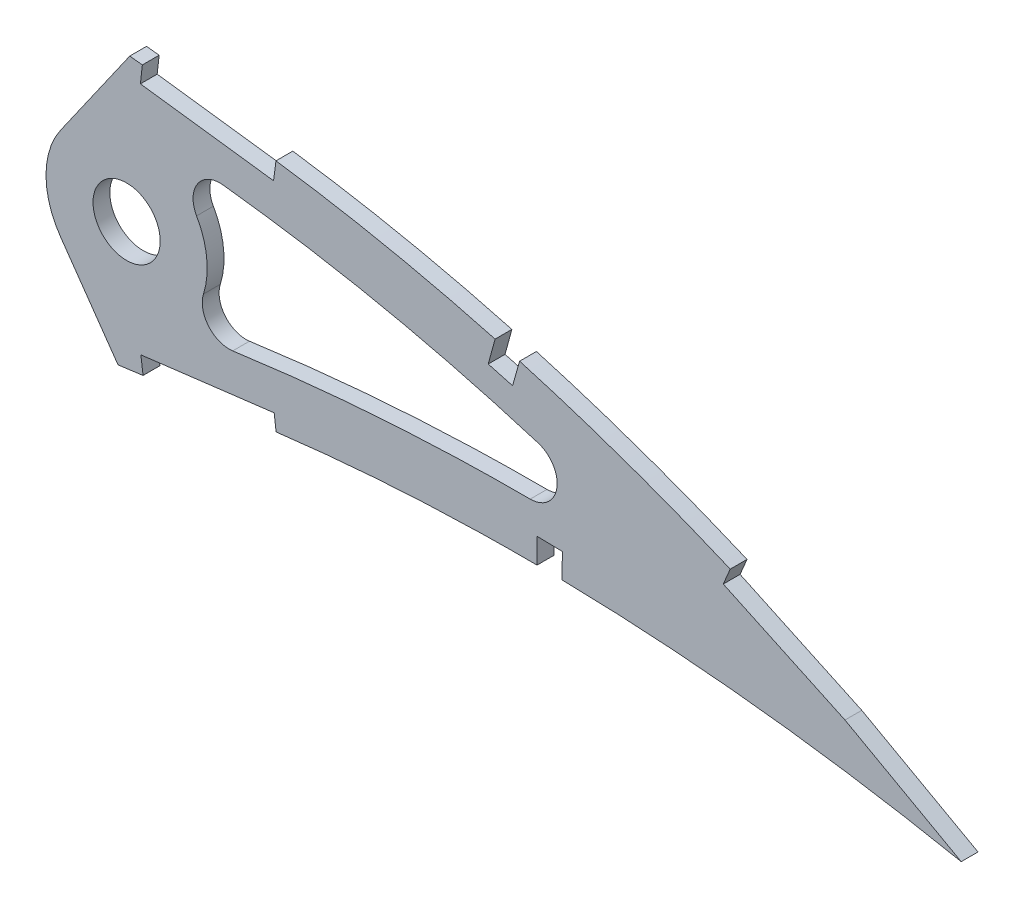
from build123d import *

# Parameters (mm, degrees)
BOSS_EXTRUDE1_DEPTH = 3.175
SKETCH3_R           = 6.35
CUT_EXTRUDE2_DEPTH  = 7.62
CUT_EXTRUDE3_DEPTH  = 477.963187519
CUT_EXTRUDE4_DEPTH  = 477.282156445
FILLET1_R           = 5.08


with BuildPart() as part:
    # Sketch1 → Boss-Extrude1 (new body)
    with BuildSketch(Plane.XY):
        with BuildLine():
            Line((468.834634376, -0.731838708), (473.237631437, -1.626460605))
            Line((473.237631437, -1.626460605), (469.420105342, 0.731838708))
            add(Edge.make_bspline(
                [(469.420105342, 0.731838708), (469.384144743, 0.75405358), (469.240441949, 0.842826831), (468.916653521, 1.041434293), (468.377478456, 1.372225024), (467.622680377, 1.832901279), (466.652845475, 2.422239826), (465.467485908, 3.136113979), (464.067341521, 3.972204372), (462.452751187, 4.926556606), (460.623880493, 5.99470234), (458.581425768, 7.172314172), (456.325564704, 8.452725095), (453.857171213, 9.830703338), (451.177092175, 11.299695359), (448.285834578, 12.853066351), (445.184433662, 14.482914856), (441.87408004, 16.182230896), (438.355377166, 17.941630348), (434.629984045, 19.753790881), (430.699141968, 21.609677497), (426.564192467, 23.499388025), (422.22751115, 25.41521975), (417.69029685, 27.345261464), (412.955135305, 29.281151436), (408.024042449, 31.211871947), (402.899937976, 33.12863011), (397.58479872, 35.019008566), (392.082597846, 36.874746386), (386.396004495, 38.68378787), (380.529085336, 40.436308543), (374.485249168, 42.120945686), (368.269534158, 43.72905958), (361.885882446, 45.248939331), (355.339704572, 46.670411418), (348.63620397, 47.984917711), (341.781002635, 49.179334611), (334.793097003, 50.252730987), (327.784920922, 51.145614984), (320.79116359, 52.021329621), (313.807821665, 52.843983365), (306.739128647, 53.631788144), (299.591885106, 54.380308437), (292.373180531, 55.087203561), (285.090322746, 55.749422771), (277.750880063, 56.365023912), (270.361954303, 56.930518839), (262.931336863, 57.445036287), (255.466373755, 57.904053071), (247.975016147, 58.307224442), (240.464868712, 58.651738691), (232.943747029, 58.935221873), (225.419637453, 59.155962801), (217.900350262, 59.311846649), (210.394026923, 59.401893322), (202.908475182, 59.423642443), (195.451832721, 59.376704816), (188.031907868, 59.259468925), (180.656846602, 59.07032975), (173.334467891, 58.808934388), (166.072689758, 58.475396129), (158.879463115, 58.066921878), (151.76259133, 57.586114694), (144.729999608, 57.030954849), (137.789414782, 56.401294687), (130.948110641, 55.699758895), (124.213703919, 54.924439317), (117.593411838, 54.077542083), (111.094475675, 53.160727588), (104.72418742, 52.173496373), (98.489371058, 51.118700137), (92.396755747, 49.997417995), (86.452787451, 48.81293722), (80.663937566, 47.565566874), (75.036333929, 46.259048591), (69.57582504, 44.895658843), (64.288280855, 43.477893405), (59.179061403, 42.009154361), (54.253333229, 40.492773824), (49.516838534, 38.930418047), (44.973157087, 37.328010693), (40.627870346, 35.686689303), (36.484306892, 34.011510412), (32.547322707, 32.304761192), (28.819858841, 30.571644792), (25.306133953, 28.814134252), (22.008652271, 27.037153572), (18.930724245, 25.243427453), (16.07531265, 23.436287722), (13.44361768, 21.620318123), (11.039267644, 19.796658613), (8.863088517, 17.969917436), (6.916457434, 16.142876281), (5.20215694, 14.316793669), (3.720125296, 12.494885385), (2.472304781, 10.678594294), (1.458911867, 8.869639065), (0.682238714, 7.069333725), (0.141515122, 5.278690749), (-0.154473369, 3.500353053), (-0.228146672, 1.732894981), (-0.07593526, 0.576768576), (0, 0)],
                knots=[0, 0, 0, 0, 0.00025409, 0.001015373, 0.002283359, 0.004056577, 0.006330982, 0.009105274, 0.012374489, 0.016134023, 0.020379661, 0.025105976, 0.030306237, 0.035972206, 0.042099522, 0.048678064, 0.055701664, 0.063160184, 0.071045824, 0.079349827, 0.08806291, 0.097175757, 0.106678111, 0.116561573, 0.126814276, 0.137428301, 0.148393618, 0.15969976, 0.171338125, 0.183297699, 0.195569604, 0.208143556, 0.221011593, 0.234161831, 0.24758745, 0.261276822, 0.27522271, 0.289414144, 0.3037712, 0.317689226, 0.331784111, 0.346039677, 0.36044387, 0.374982721, 0.389640454, 0.404403317, 0.4192566, 0.434186749, 0.449177265, 0.464214782, 0.479284009, 0.49436974, 0.509457833, 0.524532346, 0.53957932, 0.554582984, 0.569529546, 0.584403417, 0.599190992, 0.613876838, 0.628447475, 0.642888675, 0.657186054, 0.671325546, 0.685294014, 0.699078147, 0.712665095, 0.726042645, 0.739197713, 0.752117586, 0.764792042, 0.777208152, 0.789355685, 0.80122396, 0.812803686, 0.824082909, 0.835054602, 0.845709571, 0.856037853, 0.866033834, 0.875688843, 0.884997719, 0.893953426, 0.902552897, 0.910789386, 0.918660734, 0.926166253, 0.933302626, 0.94007122, 0.94647478, 0.952517526, 0.958204819, 0.963546652, 0.9685566, 0.973249913, 0.977651041, 0.981787043, 0.985694226, 0.989415109, 0.993001157, 0.996508416, 1, 1, 1, 1], degree=3))
            add(Edge.make_bspline(
                [(0, 0), (0.120545422, -0.569054782), (0.362190271, -1.709779619), (1.018707782, -3.35195076), (1.886920844, -4.930552911), (2.985051288, -6.441392915), (4.305797565, -7.884057869), (5.846242644, -9.260048331), (7.604875869, -10.568624397), (9.57939547, -11.809190578), (11.766933151, -12.983063792), (14.165030149, -14.089514173), (16.771499867, -15.128195969), (19.583502489, -16.097720727), (22.597600275, -16.999564994), (25.810927556, -17.83153108), (29.219830482, -18.594781746), (32.82103031, -19.287368785), (36.610602861, -19.909995783), (40.584611298, -20.462314276), (44.738976581, -20.94466978), (49.069622971, -21.356050059), (53.572267018, -21.697340041), (58.242420882, -21.968766107), (63.07555133, -22.171188915), (68.067028727, -22.30383895), (73.21196449, -22.368784292), (78.505709034, -22.366999873), (83.943083827, -22.298008468), (89.519444052, -22.165621357), (95.229438588, -21.969000009), (101.06791245, -21.710523747), (107.029599259, -21.392793842), (113.109152024, -21.016887343), (119.301220533, -20.584470276), (125.600428387, -20.099010447), (132.001053313, -19.561718629), (138.497513135, -18.97572672), (145.084056477, -18.343968166), (151.754992696, -17.668442476), (158.504433487, -16.952327301), (165.326367256, -16.197943271), (172.214990615, -15.40931492), (179.164010856, -14.587869186), (186.167551809, -13.738296088), (193.219024932, -12.862218898), (200.312533746, -11.963011893), (207.44169833, -11.044909074), (214.599844565, -10.107805674), (221.780951957, -9.158378258), (228.978095261, -8.195844739), (236.185009877, -7.225155571), (243.39502444, -6.249327898), (250.601116302, -5.268662037), (257.796951099, -4.287222096), (264.975853334, -3.307702419), (272.13079123, -2.33019238), (279.255291474, -1.35955068), (286.342179994, -0.395658656), (293.38492181, 0.559529456), (300.37676799, 1.503162571), (307.311122172, 2.434049592), (314.180831105, 3.351601668), (320.978983246, 4.256163344), (327.596964914, 5.120278953), (334.01748331, 5.989962795), (340.262174398, 6.702910859), (346.429111082, 7.311437642), (352.524699362, 7.810345682), (358.541619746, 8.206812681), (364.472978221, 8.503671562), (370.311705825, 8.705066897), (376.050427401, 8.816973355), (381.681975143, 8.842230751), (387.198662126, 8.788893941), (392.593313409, 8.66126226), (397.85839984, 8.46506453), (402.98657623, 8.20692007), (407.970558399, 7.89386613), (412.802863889, 7.530520429), (417.476759125, 7.125365523), (421.985033014, 6.684332445), (426.320762922, 6.212460013), (430.477622429, 5.719635759), (434.44895803, 5.209104646), (438.228796305, 4.68925635), (441.811052689, 4.165359017), (445.190053843, 3.644101417), (448.360490845, 3.130455994), (451.317242447, 2.631240452), (454.055677032, 2.151118888), (456.571042556, 1.694780117), (458.859849552, 1.267981745), (460.917577703, 0.872844052), (462.741474942, 0.515878932), (464.328149845, 0.198661447), (465.675276413, -0.074339095), (466.780502068, -0.302045374), (467.642148233, -0.480719316), (468.258513042, -0.610646491), (468.628929808, -0.68795975), (468.793510743, -0.723066602), (468.834634376, -0.731838708)],
                knots=[0, 0, 0, 0, 0.003638255, 0.007293231, 0.011028136, 0.014901081, 0.018963272, 0.023258475, 0.027820626, 0.032679082, 0.03785316, 0.043361875, 0.049214679, 0.055422346, 0.061988786, 0.068918036, 0.076211157, 0.083868392, 0.091887411, 0.100265912, 0.108999867, 0.118084529, 0.127514843, 0.13728527, 0.147387917, 0.157816481, 0.168563473, 0.179619128, 0.190977373, 0.202626974, 0.214560478, 0.226767249, 0.239236417, 0.251959004, 0.264923894, 0.278119703, 0.291536035, 0.30516028, 0.318980685, 0.332985499, 0.34716279, 0.361498603, 0.375980747, 0.390597192, 0.405332593, 0.420174823, 0.435109533, 0.450124276, 0.465203068, 0.480333154, 0.495500583, 0.510689775, 0.525887334, 0.541078314, 0.556247233, 0.571381785, 0.58646604, 0.601484516, 0.616424329, 0.631269423, 0.646006524, 0.660620684, 0.675098188, 0.689422858, 0.703581824, 0.716907564, 0.730009274, 0.742952128, 0.755725558, 0.768319952, 0.780724337, 0.792926528, 0.804916041, 0.816679084, 0.828203524, 0.8394749, 0.850481359, 0.861207697, 0.871639326, 0.881763414, 0.891563605, 0.901027364, 0.910138977, 0.918883976, 0.927249278, 0.935221104, 0.942784738, 0.949928188, 0.956638464, 0.962904204, 0.968712288, 0.974054485, 0.978918432, 0.983297218, 0.987180246, 0.990560674, 0.993433357, 0.995790626, 0.997629587, 0.998945816, 0.999736592, 1, 1, 1, 1], degree=3))
        make_face()
    extrude(amount=BOSS_EXTRUDE1_DEPTH)

    # Sketch3 → Cut-Extrude2 (cut)
    with BuildSketch(Plane(origin=(0, 0, 0), x_dir=(-1, 0, 0), z_dir=(0, 0, -1))):
        with Locations((-305.693087566, 26.255421435)):
            Circle(SKETCH3_R)
    extrude(amount=-CUT_EXTRUDE2_DEPTH, mode=Mode.SUBTRACT)

    # Sketch5 → Cut-Extrude3 (cut, through all)
    with BuildSketch(Plane.XY.offset(3.175)):
        with BuildLine():
            Line((297.512883475, 11.367834437), (293.209210411, 17.514116545))
            ThreePointArc((293.209210411, 17.514116545), (290.453087566, 26.255421435), (293.209210411, 34.996726325))
            Line((293.209210411, 34.996726325), (299.622888229, 44.156407516))
            Line((299.622888229, 44.156407516), (306.28625024, 53.672674691))
            add(Edge.make_bspline(
                [(306.28625024, 53.672674691), (304.062685855, 53.912052152), (299.432854271, 54.395881608), (292.373180531, 55.087203561), (285.090322746, 55.749422771), (277.750880063, 56.365023912), (270.361954303, 56.930518839), (262.931336863, 57.445036287), (255.466373755, 57.904053071), (247.975016147, 58.307224442), (240.464868712, 58.651738691), (232.943747029, 58.935221873), (225.419637453, 59.155962801), (217.900350262, 59.311846649), (210.394026923, 59.401893322), (202.908475182, 59.423642443), (195.451832721, 59.376704816), (188.031907868, 59.259468925), (180.656846602, 59.07032975), (173.334467891, 58.808934388), (166.072689758, 58.475396129), (159.219577295, 58.086235587), (154.78924534, 57.790330672), (152.756670288, 57.644702109)],
                knots=[0.347000218, 0.347000218, 0.347000218, 0.347000218, 0.36044387, 0.374982721, 0.389640454, 0.404403317, 0.4192566, 0.434186749, 0.449177265, 0.464214782, 0.479284009, 0.49436974, 0.509457833, 0.524532346, 0.53957932, 0.554582984, 0.569529546, 0.584403417, 0.599190992, 0.613876838, 0.628447475, 0.642888675, 0.655138283, 0.655138283, 0.655138283, 0.655138283], degree=3))
            add(Edge.make_bspline(
                [(152.756670288, 57.644702109), (152.416884114, 57.620357339), (149.731090186, 57.425745956), (144.729999608, 57.030954849), (137.789414782, 56.401294687), (130.948110641, 55.699758895), (124.213703919, 54.924439317), (117.593411838, 54.077542083), (111.094475675, 53.160727588), (104.72418742, 52.173496373), (98.489371058, 51.118700137), (92.396755747, 49.997417995), (86.452787451, 48.81293722), (80.663937566, 47.565566874), (75.036333929, 46.259048591), (69.57582504, 44.895658843), (64.288280855, 43.477893405), (59.179061403, 42.009154361), (54.253333229, 40.492773824), (49.516838534, 38.930418047), (44.973157087, 37.328010693), (40.627870346, 35.686689303), (36.484306892, 34.011510412), (32.547322707, 32.304761192), (28.819858841, 30.571644792), (25.306133953, 28.814134252), (22.008652271, 27.037153572), (18.930724245, 25.243427453), (16.07531265, 23.436287722), (13.44361768, 21.620318123), (11.039267644, 19.796658613), (8.863088517, 17.969917436), (6.916457434, 16.142876281), (5.20215694, 14.316793669), (3.720125296, 12.494885385), (2.472304781, 10.678594294), (1.458911867, 8.869639065), (0.682238714, 7.069333725), (0.141515122, 5.278690749), (-0.154473369, 3.500353053), (-0.228146672, 1.732894981), (-0.07593526, 0.576768576), (0, 0)],
                knots=[0.655138283, 0.655138283, 0.655138283, 0.655138283, 0.657186054, 0.671325546, 0.685294014, 0.699078147, 0.712665095, 0.726042645, 0.739197713, 0.752117586, 0.764792042, 0.777208152, 0.789355685, 0.80122396, 0.812803686, 0.824082909, 0.835054602, 0.845709571, 0.856037853, 0.866033834, 0.875688843, 0.884997719, 0.893953426, 0.902552897, 0.910789386, 0.918660734, 0.926166253, 0.933302626, 0.94007122, 0.94647478, 0.952517526, 0.958204819, 0.963546652, 0.9685566, 0.973249913, 0.977651041, 0.981787043, 0.985694226, 0.989415109, 0.993001157, 0.996508416, 1, 1, 1, 1], degree=3))
            add(Edge.make_bspline(
                [(0, 0), (0.120545422, -0.569054782), (0.362190271, -1.709779619), (1.018707782, -3.35195076), (1.886920844, -4.930552911), (2.985051288, -6.441392915), (4.305797565, -7.884057869), (5.846242644, -9.260048331), (7.604875869, -10.568624397), (9.57939547, -11.809190578), (11.766933151, -12.983063792), (14.165030149, -14.089514173), (16.771499867, -15.128195969), (19.583502489, -16.097720727), (22.597600275, -16.999564994), (25.810927556, -17.83153108), (29.219830482, -18.594781746), (32.82103031, -19.287368785), (36.610602861, -19.909995783), (40.584611298, -20.462314276), (44.738976581, -20.94466978), (49.069622971, -21.356050059), (53.572267018, -21.697340041), (58.242420882, -21.968766107), (63.07555133, -22.171188915), (68.067028727, -22.30383895), (73.21196449, -22.368784292), (78.505709034, -22.366999873), (83.943083827, -22.298008468), (89.519444052, -22.165621357), (95.229438588, -21.969000009), (101.06791245, -21.710523747), (107.029599259, -21.392793842), (113.109152024, -21.016887343), (119.301220533, -20.584470276), (125.600428387, -20.099010447), (132.001053313, -19.561718629), (138.497513135, -18.97572672), (145.084056477, -18.343968166), (151.754992696, -17.668442476), (158.504433487, -16.952327301), (165.326367256, -16.197943271), (172.214990615, -15.40931492), (178.413668021, -14.676567434), (182.315287371, -14.20522514), (183.900274287, -14.012143441)],
                knots=[0, 0, 0, 0, 0.003638255, 0.007293231, 0.011028136, 0.014901081, 0.018963272, 0.023258475, 0.027820626, 0.032679082, 0.03785316, 0.043361875, 0.049214679, 0.055422346, 0.061988786, 0.068918036, 0.076211157, 0.083868392, 0.091887411, 0.100265912, 0.108999867, 0.118084529, 0.127514843, 0.13728527, 0.147387917, 0.157816481, 0.168563473, 0.179619128, 0.190977373, 0.202626974, 0.214560478, 0.226767249, 0.239236417, 0.251959004, 0.264923894, 0.278119703, 0.291536035, 0.30516028, 0.318980685, 0.332985499, 0.34716279, 0.361498603, 0.375980747, 0.390597192, 0.400599477, 0.400599477, 0.400599477, 0.400599477], degree=3))
            Line((183.900274287, -14.012143441), (182.671674675, -3.926701309))
            add(Edge.make_bspline(
                [(182.671674675, -3.926701309), (194.509091827, -2.484677654), (218.145124651, 0.570902493), (247.751689591, 4.59382325), (271.453325847, 7.832408284), (286.063540768, 9.821970798), (294.75504791, 10.996225318), (297.512883475, 11.367834437)],
                knots=[0.400599477, 0.400599477, 0.400599477, 0.400599477, 0.475524542, 0.550449608, 0.587912141, 0.625374673, 0.642787324, 0.642787324, 0.642787324, 0.642787324], degree=3))
        make_face()
        with BuildLine():
            Line((304.072913741, 1.999140288), (297.512883475, 11.367834437))
            add(Edge.make_bspline(
                [(182.671674675, -3.926701309), (194.509091827, -2.484677654), (218.145124651, 0.570902493), (247.751689591, 4.59382325), (271.453325847, 7.832408284), (286.063540768, 9.821970798), (294.75504791, 10.996225318), (297.512883475, 11.367834437)],
                knots=[0.400599477, 0.400599477, 0.400599477, 0.400599477, 0.475524542, 0.550449608, 0.587912141, 0.625374673, 0.642787324, 0.642787324, 0.642787324, 0.642787324], degree=3))
            Line((182.671674675, -3.926701309), (183.900274287, -14.012143441))
            add(Edge.make_bspline(
                [(183.900274287, -14.012143441), (184.650295648, -13.920776504), (187.752075182, -13.541434417), (193.219024932, -12.862218898), (200.312533746, -11.963011893), (207.44169833, -11.044909074), (214.599844565, -10.107805674), (221.780951957, -9.158378258), (228.978095261, -8.195844739), (236.185009877, -7.225155571), (243.39502444, -6.249327898), (250.601116302, -5.268662037), (257.796951099, -4.287222096), (264.975853334, -3.307702419), (272.13079123, -2.33019238), (279.255291474, -1.35955068), (286.342179994, -0.395658656), (293.38492181, 0.559529456), (299.290252779, 1.356524372), (302.847355272, 1.834638254), (304.072913741, 1.999140288)],
                knots=[0.400599477, 0.400599477, 0.400599477, 0.400599477, 0.405332593, 0.420174823, 0.435109533, 0.450124276, 0.465203068, 0.480333154, 0.495500583, 0.510689775, 0.525887334, 0.541078314, 0.556247233, 0.571381785, 0.58646604, 0.601484516, 0.616424329, 0.631269423, 0.646006524, 0.653752682, 0.653752682, 0.653752682, 0.653752682], degree=3))
        make_face()
        with BuildLine():
            ThreePointArc((323.963245575, 41.38375935), (319.105220017, 39.160601573), (318.92248425, 33.821177403))
            ThreePointArc((318.92248425, 33.821177403), (320.421862217, 30.169600438), (320.933087566, 26.255421435))
            ThreePointArc((320.933087566, 26.255421435), (319.141171906, 19.085579904), (314.186810981, 13.601794976))
            add(Edge.make_bspline(
                [(314.186810981, 13.601794976), (314.770369848, 13.679448559), (316.839424195, 13.954520017), (320.400865114, 14.426308147), (324.846022745, 15.007024156), (329.250239262, 15.599262537), (333.841569886, 16.194898181), (338.429624656, 16.716888646), (347.573325078, 17.657008471), (361.374068863, 18.662672255), (379.786507532, 19.131635965), (397.590418024, 18.759722594), (409.224653606, 18.017132069), (414.729715702, 17.55731843)],
                knots=[0.677887055, 0.677887055, 0.677887055, 0.677887055, 0.681568472, 0.690934105, 0.700299739, 0.709665372, 0.719031005, 0.728396638, 0.737762271, 0.775224804, 0.812687337, 0.850149869, 0.883923306, 0.883923306, 0.883923306, 0.883923306], degree=3))
            add(Edge.make_bspline(
                [(414.729715702, 17.55731843), (413.495056563, 18.076609121), (406.144215059, 21.11795465), (392.493349368, 26.215886187), (373.537808804, 32.037686314), (357.474318794, 35.923573168), (346.138104248, 38.119647891), (339.615899628, 39.226410516), (334.729973243, 39.983396346), (329.989581028, 40.625614959), (326.342829232, 41.085317779), (324.383215707, 41.331189805), (323.963245575, 41.38375935)],
                knots=[0.114549081, 0.114549081, 0.114549081, 0.114549081, 0.122838428, 0.163784571, 0.204730714, 0.245676856, 0.266149928, 0.276386463, 0.286622999, 0.296859535, 0.306234702, 0.308793836, 0.308793836, 0.308793836, 0.308793836], degree=3))
        make_face()
    extrude(amount=-CUT_EXTRUDE3_DEPTH, mode=Mode.SUBTRACT)

    # Sketch6 → Cut-Extrude4 (cut, through all)
    with BuildSketch(Plane.XY.offset(3.175)):
        with BuildLine():
            add(Edge.make_bspline(
                [(333.929911323, 50.341851873), (331.859314578, 50.626471459), (327.488961608, 51.182673162), (320.79116359, 52.021329621), (314.442152858, 52.769257691), (310.390101293, 53.224342073), (308.667703913, 53.413625761)],
                knots=[0.291207141, 0.291207141, 0.291207141, 0.291207141, 0.3037712, 0.317689226, 0.331784111, 0.342200224, 0.342200224, 0.342200224, 0.342200224], degree=3))
            Line((333.929911323, 50.341851873), (334.512065277, 54.823626972))
            Line((334.512065277, 54.823626972), (309.146518106, 57.674243029))
            Line((309.146518106, 57.674243029), (308.667703913, 53.413625761))
        make_face()
        Polygon((308.652395584, 53.277408137), (308.297850756, 50.122573044), (333.476163247, 46.848623298), (333.885132121, 49.99711435), align=None)
        with BuildLine():
            Line((377.256283552, 48.81691022), (375.355182384, 41.865517827))
            add(Edge.make_bspline(
                [(379.995119199, 40.570141398), (378.451581941, 41.012961679), (376.904875173, 41.44473681), (375.355182384, 41.865517827)],
                knots=[0.196772604, 0.196772604, 0.196772604, 0.196772604, 0.206425369, 0.206425369, 0.206425369, 0.206425369], degree=3))
            Line((379.995119199, 40.570141398), (381.952411943, 47.532589804))
            Line((381.952411943, 47.532589804), (377.256283552, 48.81691022))
        make_face()
        Polygon((375.317230972, 41.726748172), (374.060981287, 37.133260641), (378.654468816, 35.877010948), (379.953838632, 40.423298869), align=None)
        with BuildLine():
            Line((422.639110826, 33.097771033), (419.814536432, 26.438469199))
            add(Edge.make_bspline(
                [(469.420105342, 0.731838708), (469.384144743, 0.75405358), (469.240441949, 0.842826831), (468.916653521, 1.041434293), (468.377478456, 1.372225024), (467.622680377, 1.832901279), (466.652845475, 2.422239826), (465.467485908, 3.136113979), (464.067341521, 3.972204372), (462.452751187, 4.926556606), (460.623880493, 5.99470234), (458.581425768, 7.172314172), (456.325564704, 8.452725095), (453.857171213, 9.830703338), (451.177092175, 11.299695359), (448.285834578, 12.853066351), (445.184433662, 14.482914856), (441.87408004, 16.182230896), (438.355377166, 17.941630348), (434.629984045, 19.753790881), (430.699141968, 21.609677497), (426.564192467, 23.499388025), (422.913014033, 25.112382609), (420.638113453, 26.088706889), (419.814536432, 26.438469199)],
                knots=[0, 0, 0, 0, 0.00025409, 0.001015373, 0.002283359, 0.004056577, 0.006330982, 0.009105274, 0.012374489, 0.016134023, 0.020379661, 0.025105976, 0.030306237, 0.035972206, 0.042099522, 0.048678064, 0.055701664, 0.063160184, 0.071045824, 0.079349827, 0.08806291, 0.097175757, 0.106678111, 0.112056765, 0.112056765, 0.112056765, 0.112056765], degree=3))
            Line((469.420105342, 0.731838708), (473.237631437, -1.626460605))
            Line((473.237631437, -1.626460605), (468.834634376, -0.731838708))
            add(Edge.make_bspline(
                [(463.749174115, 0.314183331), (463.968637418, 0.270270157), (464.637675863, 0.135934772), (465.675276413, -0.074339095), (466.780502068, -0.302045374), (467.642148233, -0.480719316), (468.258513042, -0.610646491), (468.628929808, -0.68795975), (468.793510743, -0.723066602), (468.834634376, -0.731838708)],
                knots=[0.989158632, 0.989158632, 0.989158632, 0.989158632, 0.990560674, 0.993433357, 0.995790626, 0.997629587, 0.998945816, 0.999736592, 1, 1, 1, 1], degree=3))
            Line((463.749174115, 0.314183331), (463.708217496, 0.240451635))
            Line((463.708217496, 0.240451635), (477.098083011, -7.197375657))
            Line((477.098083011, -7.197375657), (481.361821085, 0.478371192))
            Line((481.361821085, 0.478371192), (422.639110826, 33.097771033))
        make_face()
        with BuildLine():
            add(Edge.make_bspline(
                [(383.284143211, 8.821702739), (384.602443262, 8.812950046), (386.170805311, 8.794643543), (387.739009395, 8.766883068), (387.989086643, 8.762215879)],
                knots=[0.819945141, 0.819945141, 0.819945141, 0.819945141, 0.828203524, 0.829770352, 0.829770352, 0.829770352, 0.829770352], degree=3))
            Line((387.989086643, 8.762215879), (388.085526515, 13.444014284))
            Line((388.085526515, 13.444014284), (383.32453269, 13.542120476))
            Line((383.32453269, 13.542120476), (383.28414321, 8.821702739))
        make_face()
        Polygon((383.231357966, 2.65256153), (387.863234516, 2.65256153), (387.98804622, 8.711707232), (383.283788284, 8.780221608), align=None)
        with BuildLine():
            Line((308.38825603, 5.800209772), (308.801977154, 2.652337229))
            Line((308.801977154, 2.652337229), (310.701505473, 2.886714965))
            add(Edge.make_bspline(
                [(310.701505473, 2.886714965), (311.869345474, 3.042728563), (315.303820941, 3.501026622), (320.978983246, 4.256163344), (327.564082502, 5.115985468), (331.879148983, 5.700318423), (333.95703077, 5.960133358)],
                knots=[0.667717454, 0.667717454, 0.667717454, 0.667717454, 0.675098188, 0.689422858, 0.703581824, 0.716699828, 0.716699828, 0.716699828, 0.716699828], degree=3))
            Line((333.95703077, 5.960133358), (333.591696942, 8.909442836))
            Line((333.591696942, 8.909442836), (308.38825603, 5.800209772))
        make_face()
        with BuildLine():
            add(Edge.make_bspline(
                [(308.804349352, 2.633111611), (309.436727547, 2.717699531), (310.069113071, 2.802232662), (310.701505473, 2.886714965)],
                knots=[0.663720743, 0.663720743, 0.663720743, 0.663720743, 0.667717454, 0.667717454, 0.667717454, 0.667717454], degree=3))
            Line((308.804349352, 2.633111611), (309.311930258, -1.480608059))
            Line((309.311930258, -1.480608059), (334.491870837, 1.626277701))
            Line((334.491870837, 1.626277701), (333.981917733, 5.759222988))
            Line((333.981917733, 5.759222988), (310.701505473, 2.886714965))
        make_face()
        with BuildLine():
            Line((308.652395584, 53.277408137), (333.885132121, 49.99711435))
            Line((333.885132121, 49.99711435), (333.929911323, 50.341851873))
            add(Edge.make_bspline(
                [(333.929911323, 50.341851873), (331.859314578, 50.626471459), (327.488961608, 51.182673162), (320.79116359, 52.021329621), (314.442152858, 52.769257691), (310.390101293, 53.224342073), (308.667703913, 53.413625761)],
                knots=[0.291207141, 0.291207141, 0.291207141, 0.291207141, 0.3037712, 0.317689226, 0.331784111, 0.342200224, 0.342200224, 0.342200224, 0.342200224], degree=3))
            Line((308.667703913, 53.413625761), (308.652395584, 53.277408137))
        make_face()
        with BuildLine():
            add(Edge.make_bspline(
                [(379.995119199, 40.570141398), (378.451581941, 41.012961679), (376.904875173, 41.44473681), (375.355182384, 41.865517827)],
                knots=[0.196772604, 0.196772604, 0.196772604, 0.196772604, 0.206425369, 0.206425369, 0.206425369, 0.206425369], degree=3))
            Line((375.355182384, 41.865517827), (375.317230972, 41.726748172))
            Line((375.317230972, 41.726748172), (379.953838632, 40.423298869))
            Line((379.953838632, 40.423298869), (379.995119199, 40.570141398))
        make_face()
        with BuildLine():
            add(Edge.make_bspline(
                [(469.420105342, 0.731838708), (469.384144743, 0.75405358), (469.240441949, 0.842826831), (468.916653521, 1.041434293), (468.377478456, 1.372225024), (467.622680377, 1.832901279), (466.652845475, 2.422239826), (465.467485908, 3.136113979), (464.067341521, 3.972204372), (462.452751187, 4.926556606), (460.623880493, 5.99470234), (458.581425768, 7.172314172), (456.325564704, 8.452725095), (453.857171213, 9.830703338), (451.177092175, 11.299695359), (448.285834578, 12.853066351), (445.184433662, 14.482914856), (441.87408004, 16.182230896), (438.355377166, 17.941630348), (434.629984045, 19.753790881), (430.699141968, 21.609677497), (426.564192467, 23.499388025), (422.913014033, 25.112382609), (420.638113453, 26.088706889), (419.814536432, 26.438469199)],
                knots=[0, 0, 0, 0, 0.00025409, 0.001015373, 0.002283359, 0.004056577, 0.006330982, 0.009105274, 0.012374489, 0.016134023, 0.020379661, 0.025105976, 0.030306237, 0.035972206, 0.042099522, 0.048678064, 0.055701664, 0.063160184, 0.071045824, 0.079349827, 0.08806291, 0.097175757, 0.106678111, 0.112056765, 0.112056765, 0.112056765, 0.112056765], degree=3))
            Line((419.814536432, 26.438469199), (419.733830693, 26.248194912))
            Line((419.733830693, 26.248194912), (418.494223412, 23.325659377))
            Line((418.494223412, 23.325659377), (441.504279945, 12.574335985))
            Line((441.504279945, 12.574335985), (463.477912059, 0.368382126))
            add(Edge.make_bspline(
                [(463.477912059, 0.368382126), (463.568337872, 0.350341588), (463.65875848, 0.33227491), (463.749174115, 0.314183331)],
                knots=[0.988581011, 0.988581011, 0.988581011, 0.988581011, 0.989158632, 0.989158632, 0.989158632, 0.989158632], degree=3))
            add(Edge.make_bspline(
                [(463.749174115, 0.314183331), (463.968637418, 0.270270157), (464.637675863, 0.135934772), (465.675276413, -0.074339095), (466.780502068, -0.302045374), (467.642148233, -0.480719316), (468.258513042, -0.610646491), (468.628929808, -0.68795975), (468.793510743, -0.723066602), (468.834634376, -0.731838708)],
                knots=[0.989158632, 0.989158632, 0.989158632, 0.989158632, 0.990560674, 0.993433357, 0.995790626, 0.997629587, 0.998945816, 0.999736592, 1, 1, 1, 1], degree=3))
            Line((468.834634376, -0.731838708), (473.237631437, -1.626460605))
            Line((473.237631437, -1.626460605), (469.420105342, 0.731838708))
        make_face()
        with BuildLine():
            add(Edge.make_bspline(
                [(310.701505473, 2.886714965), (311.869345474, 3.042728563), (315.303820941, 3.501026622), (320.978983246, 4.256163344), (327.564082502, 5.115985468), (331.879148983, 5.700318423), (333.95703077, 5.960133358)],
                knots=[0.667717454, 0.667717454, 0.667717454, 0.667717454, 0.675098188, 0.689422858, 0.703581824, 0.716699828, 0.716699828, 0.716699828, 0.716699828], degree=3))
            Line((310.701505473, 2.886714965), (333.981917733, 5.759222988))
            Line((333.981917733, 5.759222988), (333.95703077, 5.960133358))
        make_face()
        with BuildLine():
            Line((308.801977154, 2.652337229), (308.804349352, 2.633111611))
            add(Edge.make_bspline(
                [(308.804349352, 2.633111611), (309.436727547, 2.717699531), (310.069113071, 2.802232662), (310.701505473, 2.886714965)],
                knots=[0.663720743, 0.663720743, 0.663720743, 0.663720743, 0.667717454, 0.667717454, 0.667717454, 0.667717454], degree=3))
            Line((310.701505473, 2.886714965), (308.801977154, 2.652337229))
        make_face()
    extrude(amount=-CUT_EXTRUDE4_DEPTH, mode=Mode.SUBTRACT)

    # Fillet1
    fillet1_edges = [part.edges().sort_by_distance(p)[0] for p in [
        (414.729715702, 17.55731843, 1.5875),
        (314.186810981, 13.601794976, 1.5875),
    ]]
    fillet(fillet1_edges, radius=FILLET1_R)


solid = part.part
